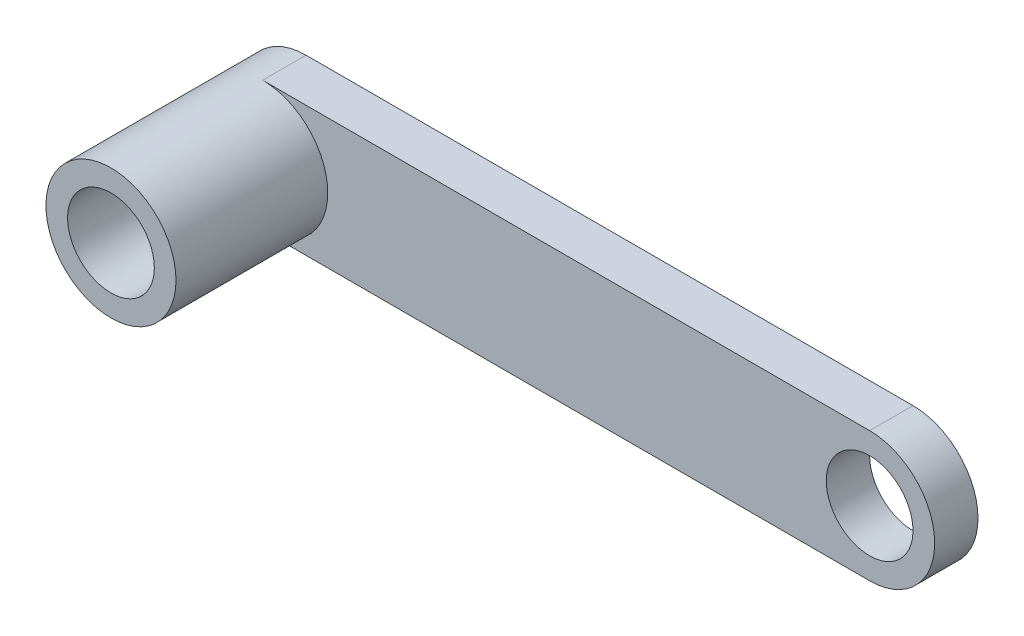
from build123d import *

# Parameters (mm, degrees)
CROQUIS1_R              = 10
SALIENTE_EXTRUIR1_DEPTH = 10
CROQUIS2_R              = 15
CROQUIS2_R_2            = 10
SALIENTE_EXTRUIR2_DEPTH = 35


with BuildPart() as part:
    # Croquis1 → Saliente-Extruir1 (new body)
    with BuildSketch(Plane.XY):
        with BuildLine():
            Line((-49.292513238, 22.5), (90.707486762, 22.5))
            ThreePointArc((90.707486762, 22.5), (105.707486762, 7.5), (90.707486762, -7.5))
            Line((90.707486762, -7.5), (-49.292513238, -7.5))
            ThreePointArc((-49.292513238, -7.5), (-64.292513238, 7.5), (-49.292513238, 22.5))
        make_face()
        with Locations((-49.292513238, 7.5)):
            Circle(CROQUIS1_R, mode=Mode.SUBTRACT)
        with Locations(Location((90.707486762, 7.5, 0), (0, 0, 180))):
            Circle(CROQUIS1_R, mode=Mode.SUBTRACT)
    extrude(amount=SALIENTE_EXTRUIR1_DEPTH)

    # Croquis2 → Saliente-Extruir2 (add)
    with BuildSketch(Plane.XY.offset(10)):
        with Locations(Location((-49.292513238, 7.5, 0), (0, 0, 270))):
            Circle(CROQUIS2_R)
        with Locations((-49.292513238, 7.5)):
            Circle(CROQUIS2_R_2, mode=Mode.SUBTRACT)
    extrude(amount=SALIENTE_EXTRUIR2_DEPTH)


solid = part.part
